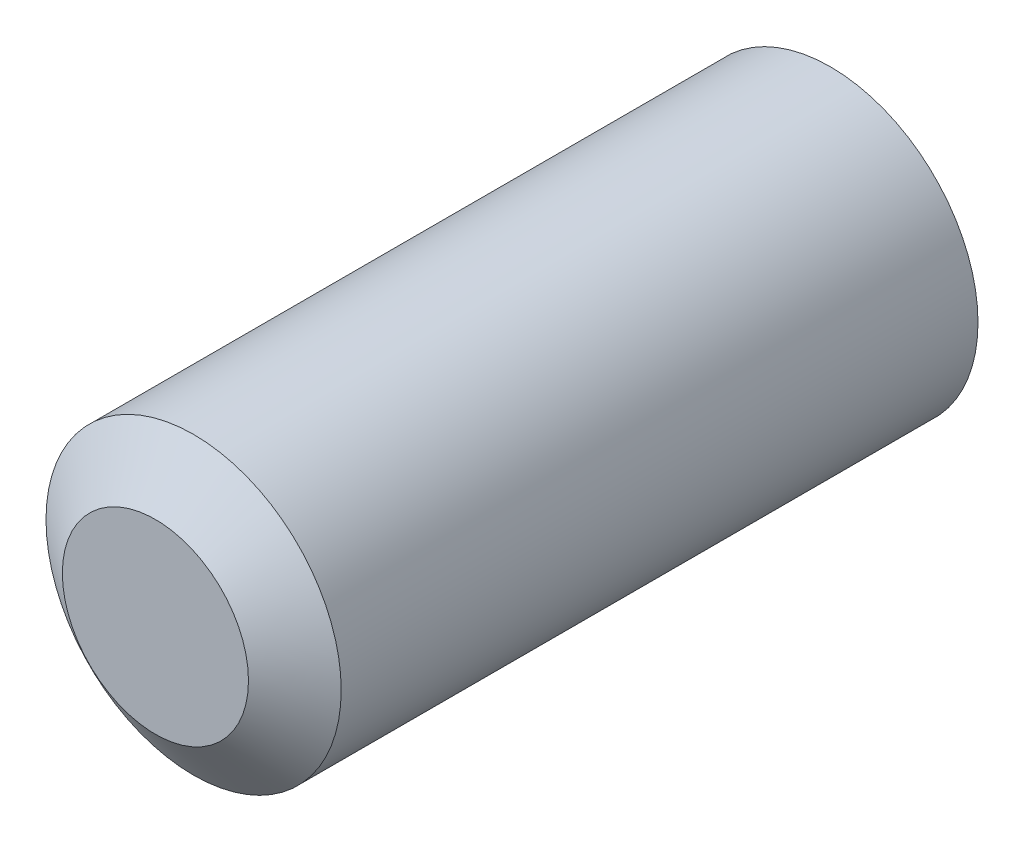
from build123d import *

# Parameters (mm, degrees)
SKETCH1_R           = 2.0828
BOSS_EXTRUDE1_DEPTH = 9.525


with BuildPart() as part:
    # Sketch1 → Boss-Extrude1 (new body)
    with BuildSketch(Plane.XY):
        Circle(SKETCH1_R)
    extrude(amount=BOSS_EXTRUDE1_DEPTH)

    # Sketch2 → Cut-Revolve1 (revolve, cut)
    with BuildSketch(Plane(origin=(0, 0, 0), x_dir=(0, 0, -1), z_dir=(1, 0, 0))):
        Polygon((-9.525, 2.0828), (-9.525, 1.313244262), (-8.986151271, 2.0828), align=None)
    revolve(axis=Axis((0, 0, 0), (0, 0, 1)), mode=Mode.SUBTRACT)


solid = part.part
